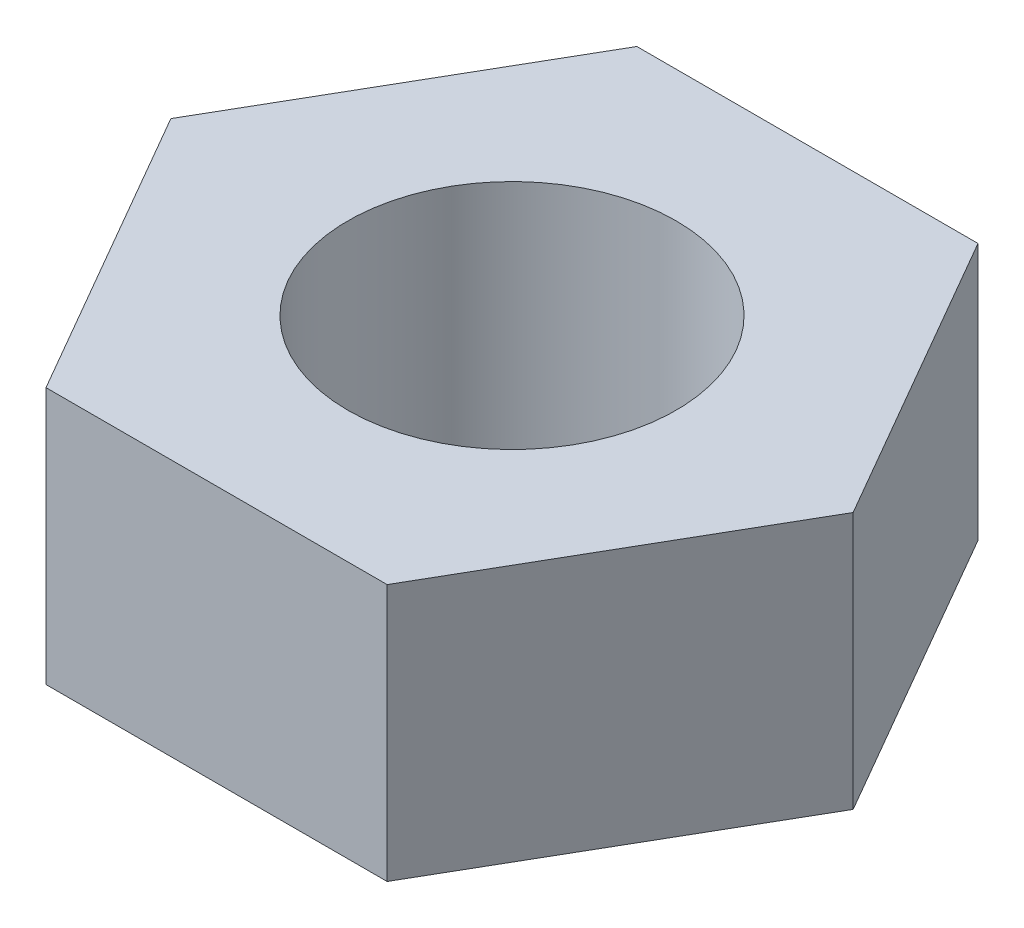
from build123d import *

# Parameters (mm, degrees)
SKETCH1_R           = 1.5
BOSS_EXTRUDE1_DEPTH = 2.35


with BuildPart() as part:
    # Sketch1 → Boss-Extrude1 (new body)
    with BuildSketch(Plane(origin=(0, 0, 0), x_dir=(1, 0, 0), z_dir=(0, 1, 0))):
        Polygon((1.558845727, -2.7), (3.117691454, 0), (1.558845727, 2.7), (-1.558845727, 2.7), (-3.117691454, 0), (-1.558845727, -2.7), align=None)
        with Locations(Location((0, 0, 0), (0, 0, 270))):
            Circle(SKETCH1_R, mode=Mode.SUBTRACT)
    extrude(amount=BOSS_EXTRUDE1_DEPTH)


solid = part.part
